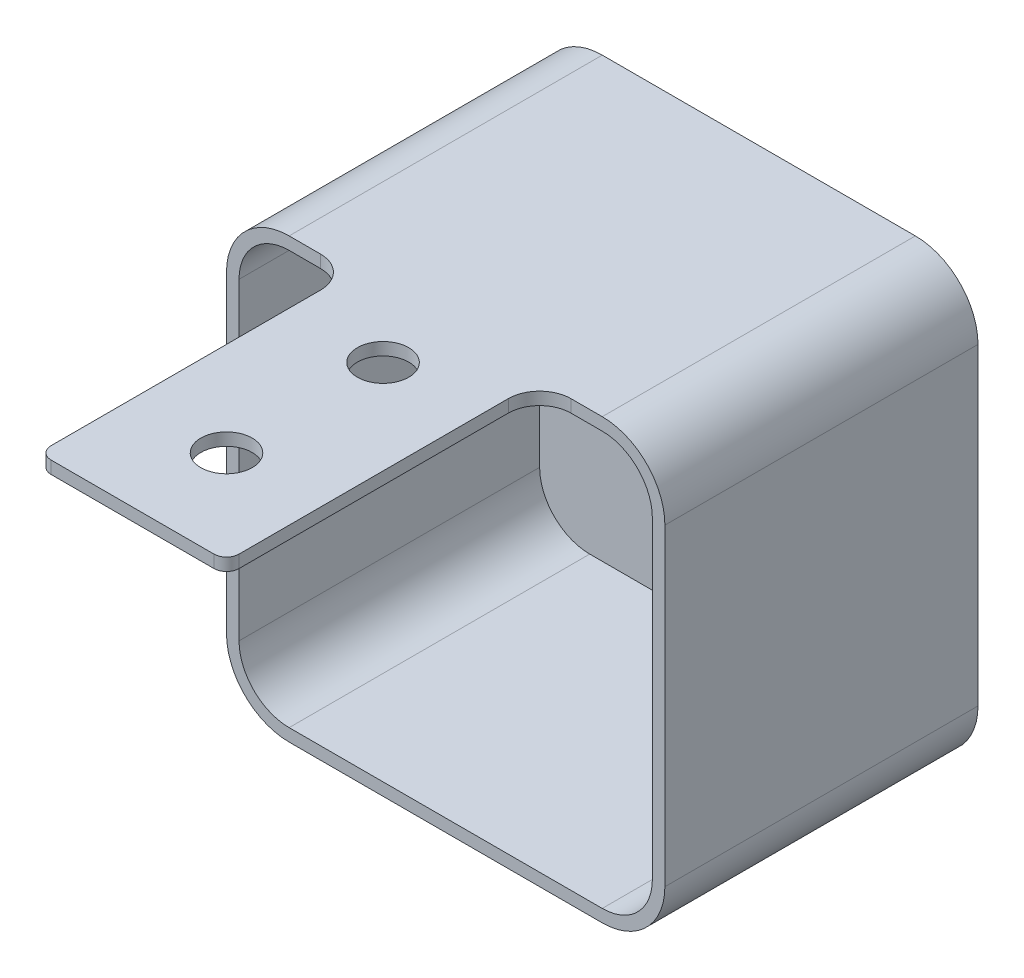
from build123d import *

# Parameters (mm, degrees)
SKETCH1_W           = 70
SKETCH1_H           = 70
BOSS_EXTRUDE1_DEPTH = 50
FILLET1_R           = 10
SHELL1_T            = -2
SKETCH2_W           = 30
SKETCH2_H           = 50
SKETCH2_R           = 4.1
BOSS_EXTRUDE2_DEPTH = 2
FILLET2_R           = 5
FILLET3_R           = 2


with BuildPart() as part:
    # Sketch1 → Boss-Extrude1 (new body)
    with BuildSketch(Plane.XY):
        Rectangle(SKETCH1_W, SKETCH1_H)
    extrude(amount=BOSS_EXTRUDE1_DEPTH)

    # Fillet1
    fillet1_edges = [part.edges().sort_by_distance(p)[0] for p in [
        (35, -35, 25),
        (-35, -35, 25),
        (-35, 35, 25),
        (35, 35, 25),
    ]]
    fillet(fillet1_edges, radius=FILLET1_R)

    # Shell1
    shell1_openings = [part.faces().sort_by_distance(p)[0] for p in [
        (0, 0, 50),
    ]]
    offset(amount=SHELL1_T, openings=shell1_openings, kind=Kind.INTERSECTION)

    # Sketch2 → Boss-Extrude2 (add)
    with BuildSketch(Plane(origin=(0, 35, 0), x_dir=(1, 0, 0), z_dir=(0, 1, 0))):
        with Locations((0, -75)):
            Rectangle(SKETCH2_W, SKETCH2_H)
        with Locations(Location((0, -85, 0), (0, 0, 270))):
            Circle(SKETCH2_R, mode=Mode.SUBTRACT)
        with Locations(Location((0, -60, 0), (0, 0, 270))):
            Circle(SKETCH2_R, mode=Mode.SUBTRACT)
    extrude(amount=-BOSS_EXTRUDE2_DEPTH)

    # Fillet2
    fillet2_edges = [part.edges().sort_by_distance(p)[0] for p in [
        (15, 34, 50),
        (-15, 34, 50),
    ]]
    fillet(fillet2_edges, radius=FILLET2_R)

    # Fillet3
    fillet3_edges = [part.edges().sort_by_distance(p)[0] for p in [
        (-15, 34, 100),
        (15, 34, 100),
    ]]
    fillet(fillet3_edges, radius=FILLET3_R)


solid = part.part
